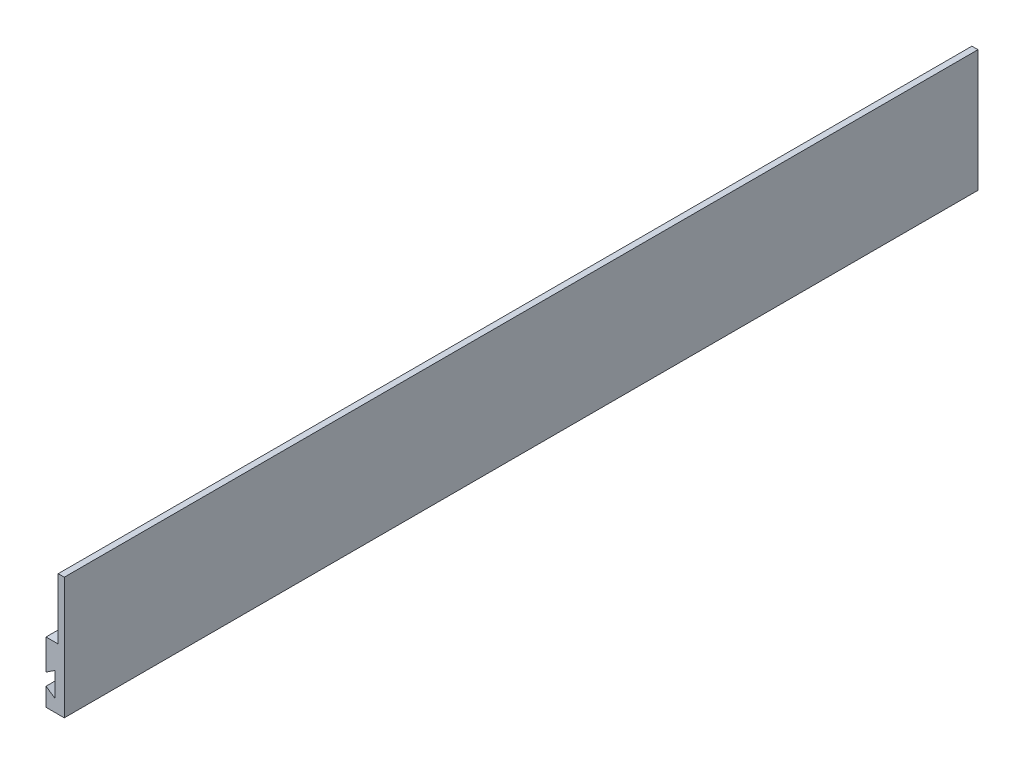
from build123d import *

# Parameters (mm, degrees)
BOSS_EXTRUDE2_DEPTH = 1500


with BuildPart() as part:
    # Sketch6 → Boss-Extrude2 (new body)
    with BuildSketch(Plane.XY):
        Polygon((-15, -50), (0, -40), (0, -80), (-15, -70), (-15, -100), (15, -100), (15, 100), (5, 100), (5, 0), (-15, 0), align=None)
    extrude(amount=BOSS_EXTRUDE2_DEPTH)


solid = part.part
